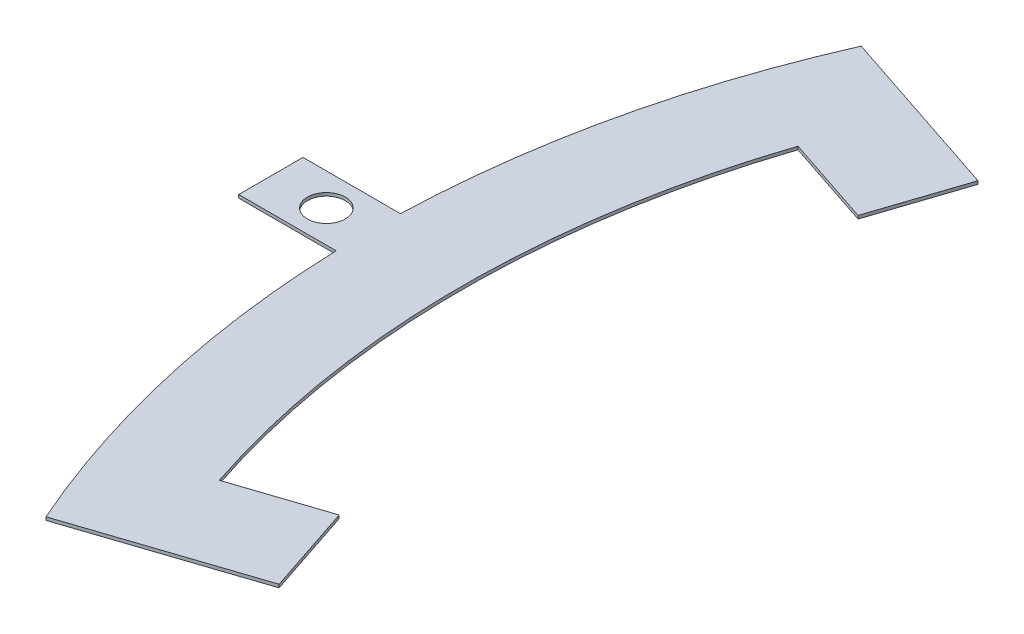
from build123d import *

# Parameters (mm, degrees)
SKETCH1_R           = 6
BOSS_EXTRUDE1_DEPTH = 1


with BuildPart() as part:
    # Sketch1 → Boss-Extrude1 (new body)
    with BuildSketch(Plane(origin=(0, 0, 0), x_dir=(1, 0, 0), z_dir=(0, 1, 0))):
        with BuildLine():
            Line((-246.822195025, 82.048831977), (-275.290477825, 91.512281372))
            ThreePointArc((-275.290477825, 91.512281372), (-290.102300616, 0), (-275.290477825, -91.512281372))
            Line((-275.290477825, -91.512281372), (-246.822195025, -82.048831977))
            Line((-246.822195025, -82.048831977), (-237.35874563, -110.517114777))
            Line((-237.35874563, -110.517114777), (-292.692887429, -128.911334562))
            ThreePointArc((-292.692887429, -128.911334562), (-311.881352351, -70.832764917), (-319.66226604, -10.163375435))
            Line((-319.66226604, -10.163375435), (-350.484670263, -10.163375435))
            Line((-350.484670263, -10.163375435), (-350.484670263, 10.163375435))
            Line((-350.484670263, 10.163375435), (-319.66226604, 10.163375435))
            ThreePointArc((-319.66226604, 10.163375435), (-311.881352351, 70.832764917), (-292.692887429, 128.911334562))
            Line((-292.692887429, 128.911334562), (-237.35874563, 110.517114777))
            Line((-237.35874563, 110.517114777), (-246.822195025, 82.048831977))
        make_face()
        with Locations(Location((-332.928005197, 0, 0), (0, 0, 270))):
            Circle(SKETCH1_R, mode=Mode.SUBTRACT)
    extrude(amount=BOSS_EXTRUDE1_DEPTH)


solid = part.part
